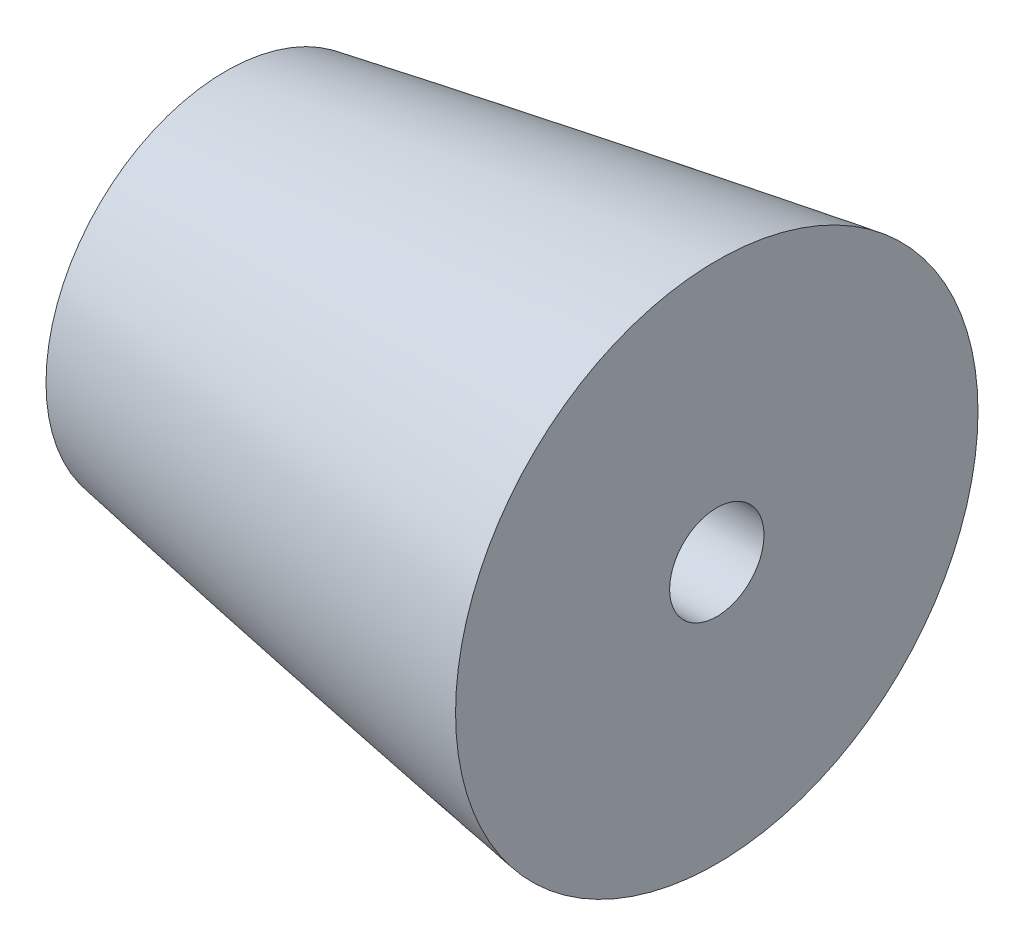
from build123d import *


with BuildPart() as part:
    # Sketch2 → Revolve1 (revolve)
    with BuildSketch(Plane.XY, mode=Mode.PRIVATE) as revolve1_sk:
        with BuildLine():
            Line((70.231327088, 3.558155589), (95.591677722, 3.558155589))
            Line((95.591677722, 3.558155589), (95.591677722, 17.307218034))
            add(Edge.make_bspline(
                [(64.051519302, 12.075596108), (64.19559288, 12.10100902), (64.464034266, 12.148295145), (64.985029002, 12.239906434), (65.551024878, 12.339266712), (66.061821421, 12.428704203), (66.518141568, 12.508347713), (67.155256609, 12.619352346), (68.031868037, 12.771804084), (68.978670443, 12.935484436), (70.325541488, 13.167684248), (72.61140148, 13.55906412), (75.925687977, 14.11996965), (79.210210587, 14.667512424), (81.873206861, 15.106387733), (83.821437235, 15.425527172), (85.864455581, 15.757276493), (87.433518438, 16.010974196), (88.803662234, 16.230869018), (89.843048676, 16.397110425), (90.793373859, 16.548866137), (91.693889578, 16.69229188), (92.720091917, 16.854910727), (93.877032143, 17.037521525), (94.844966023, 17.189946197), (95.35303026, 17.26977688), (95.579163073, 17.305254778), (95.591677722, 17.307218034)],
                knots=[0.082727838, 0.082727838, 0.082727838, 0.082727838, 0.095759116, 0.108790395, 0.121821673, 0.134852951, 0.14788423, 0.160915508, 0.186978065, 0.213040622, 0.239103179, 0.291228292, 0.395478519, 0.499728747, 0.55185386, 0.603978974, 0.656104087, 0.708229201, 0.734291758, 0.760354315, 0.786416871, 0.812479428, 0.838541985, 0.864604542, 0.890667099, 0.910808163, 0.911992461, 0.911992461, 0.911992461, 0.911992461], degree=3))
            Line((64.051519302, 12.075596108), (64.051519302, 8.783110106))
            Line((64.051519302, 8.783110106), (70.231327088, 8.783110106))
            Line((70.231327088, 8.783110106), (70.231327088, 3.558155589))
        make_face()
    revolve(revolve1_sk.sketch.rotate(Axis((70.231327088, 0.528110106, 0), (1, 0, 0)), 90), axis=Axis((70.231327088, 0.528110106, 0), (1, 0, 0)))


solid = part.part
